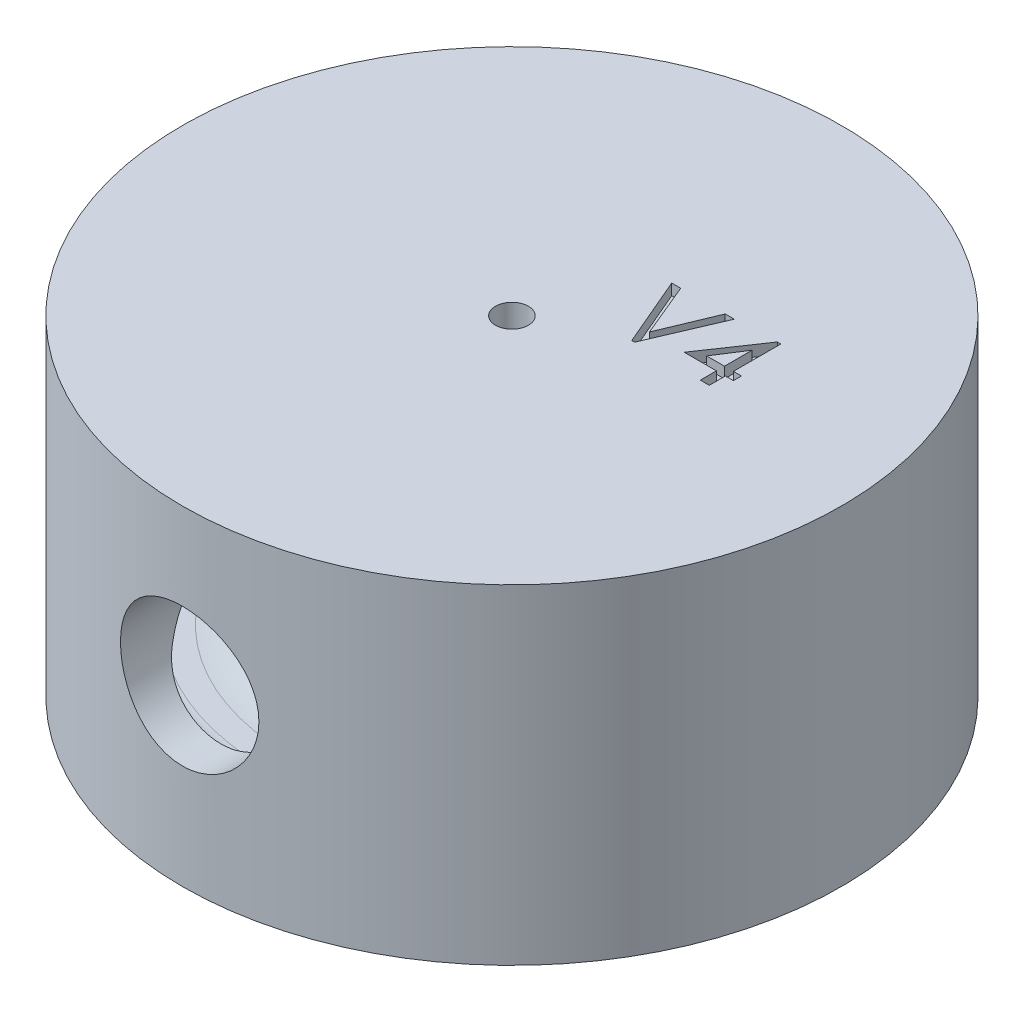
from build123d import *

# Parameters (mm, degrees)
CUT_EXTRUDE2_START = 8
SKETCH3_R          = 3.15
CUT_EXTRUDE2_DEPTH = 19.035850718
CUT_EXTRUDE3_DEPTH = 0.5


with BuildPart() as part:
    # Sketch2 → Revolve1 (revolve)
    with BuildSketch(Plane.XY, mode=Mode.PRIVATE) as revolve1_sk:
        with BuildLine():
            Line((0.75, 15.095215223), (0.75, 3.395215223))
            ThreePointArc((0.75, 3.395215223), (0.837867966, 3.183083189), (1.05, 3.095215223))
            Line((1.05, 3.095215223), (1.2, 3.095215223))
            ThreePointArc((1.2, 3.095215223), (1.412132034, 3.183083189), (1.5, 3.395215223))
            Line((1.5, 3.395215223), (1.5, 12.781039466))
            ThreePointArc((1.5, 12.781039466), (2.208615612, 13.603537029), (3.25, 13.910386965))
            Line((3.25, 13.910386965), (4.269554592, 13.910386965))
            ThreePointArc((4.269554592, 13.910386965), (6.437404554, 13.672580701), (8.502148856, 12.970472273))
            Line((8.502148856, 12.970472273), (8.589303094, 12.929756484))
            ThreePointArc((8.589303094, 12.929756484), (8.73707216, 12.862180366), (8.885919712, 12.797014155))
            ThreePointArc((8.885919712, 12.797014155), (10.067814864, 12.018656345), (10.904706183, 10.877459625))
            Line((10.904706183, 10.877459625), (12.847337494, 6.905957348))
            ThreePointArc((12.847337494, 6.905957348), (13.151127383, 6.050403517), (13.254159965, 5.148380822))
            Line((13.254159965, 5.148380822), (13.254159965, 4.920876594))
            ThreePointArc((13.254159965, 4.920876594), (12.668373527, 3.506663032), (11.254159965, 2.920876594))
            Line((11.254159965, 2.920876594), (10.187854447, 2.920876594))
            ThreePointArc((10.187854447, 2.920876594), (6.204992893, 4.835470209), (5.212547535, 9.141733912))
            Line((5.212547535, 9.141733912), (5.236002206, 9.245845457))
            Line((5.236002206, 9.245845457), (5.413981751, 10.035868278))
            ThreePointArc((5.413981751, 10.035868278), (5.308977633, 12.09484591), (3.25, 11.989841792))
            Line((3.25, 11.989841792), (3.25, 0.945215223))
            add(Edge.make_bspline(
                [(3.25, 0.945215223), (3.249999513, 0.945087469), (3.249999513, 0.944959714)],
                knots=[0, 0, 0, 0.000601201, 0.000601201, 0.000601201], degree=2))
            add(Edge.make_bspline(
                [(3.249999513, 0.944959714), (3.24914256, 0.507105342), (3.1, 0.095215223)],
                knots=[0.000291687, 0.000291687, 0.000291687, 1, 1, 1], degree=2))
            Line((3.1, 0.095215223), (3.25, 0.095215223))
            Line((3.25, 0.095215223), (15, 0.095215223))
            Line((15, 0.095215223), (15, 15.095215223))
            Line((15, 15.095215223), (0.75, 15.095215223))
        make_face()
    revolve(revolve1_sk.sketch.rotate(Axis((0, 28.78036469, 0), (0, -1, 0)), 90), axis=Axis((0, 28.78036469, 0), (0, -1, 0)))

    # Sketch3 → Cut-Extrude2 (cut, through all)
    with BuildSketch(Plane.XY.offset(CUT_EXTRUDE2_START)):
        with Locations(Location((0, 8, 0), (0, 0, 90))):
            Circle(SKETCH3_R)
    extrude(amount=CUT_EXTRUDE2_DEPTH, mode=Mode.SUBTRACT)

    # Sketch4 → Cut-Extrude3 (cut)
    # profile 1 of 2: a face of its own
    with BuildSketch(Plane(origin=(0, 15.095215223, 0), x_dir=(1, 0, 0), z_dir=(0, 1, 0))):
        Polygon((2.346723909, 4.92554133), (2.756319261, 4.92554133), (3.768859325, 2.491501867), (4.781399389, 4.92554133), (5.196082883, 4.92554133), (3.834369141, 1.75054133), (3.703985527, 1.75054133), align=None)
    # profile 2 of 2: a face of its own
    with BuildSketch(Plane(origin=(0, 15.095215223, 0), x_dir=(1, 0, 0), z_dir=(0, 1, 0))):
        Polygon((7.070426833, 5.006951587), (7.231339293, 5.006951587), (7.231339293, 2.849579792), (7.597685447, 2.849579792), (7.597685447, 2.483233638), (7.231339293, 2.483233638), (7.231339293, 1.75054133), (6.824288011, 1.75054133), (6.824288011, 2.483233638), (5.358903396, 2.483233638), align=None)
        Polygon((6.824288011, 2.849579792), (6.824288011, 4.110802748), (6.016545623, 2.849579792), align=None, mode=Mode.SUBTRACT)
    extrude(amount=-CUT_EXTRUDE3_DEPTH, mode=Mode.SUBTRACT)


solid = part.part
